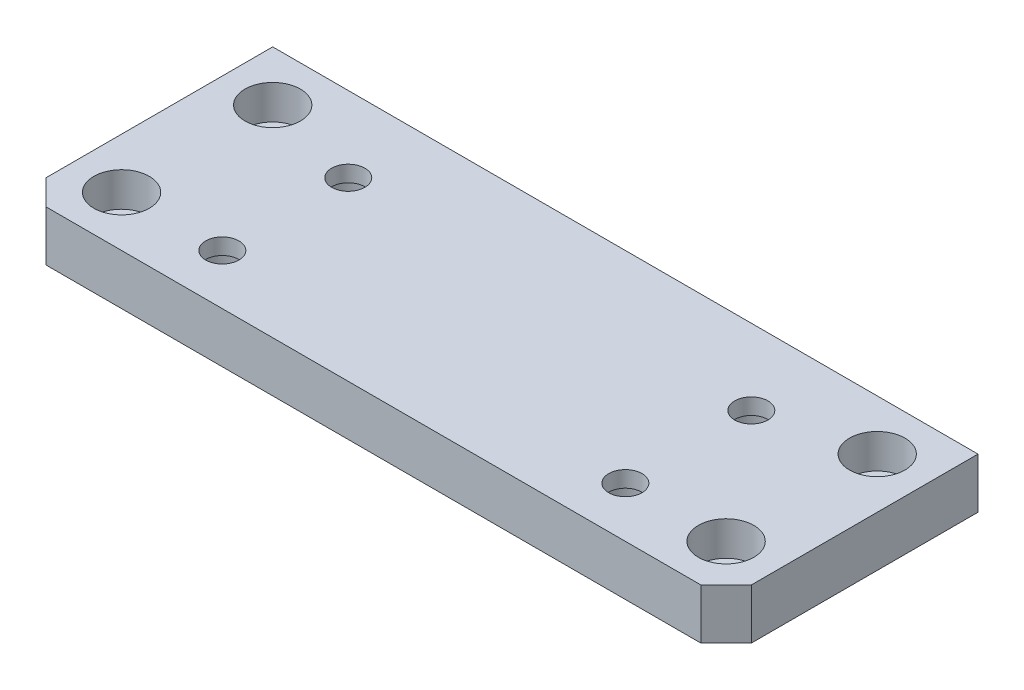
from build123d import *

# Parameters (mm, degrees)
SKETCH1_W                                            = 140
SKETCH1_H                                            = 50
BOSS_EXTRUDE1_DEPTH                                  = 10
CBORE_FOR_M6_HEXAGON_SOCKET_HEAD_CAP_SCR_D           = 6.6
CBORE_FOR_M6_HEXAGON_SOCKET_HEAD_CAP_SCR_CBORE_D     = 11
CBORE_FOR_M6_HEXAGON_SOCKET_HEAD_CAP_SCR_CBORE_DEPTH = 6.8
CBORE_FOR_M6_HEXAGON_SOCKET_HEAD_CAP_2_D             = 6.6
CBORE_FOR_M6_HEXAGON_SOCKET_HEAD_CAP_2_CBORE_D       = 11
CBORE_FOR_M6_HEXAGON_SOCKET_HEAD_CAP_2_CBORE_DEPTH   = 6.8
CHAMFER1_SIZE                                        = 5


with BuildPart() as part:
    # Sketch1 → Boss-Extrude1 (new body)
    with BuildSketch(Plane(origin=(0, 0, 0), x_dir=(1, 0, 0), z_dir=(0, 1, 0))):
        Rectangle(SKETCH1_W, SKETCH1_H)
    extrude(amount=BOSS_EXTRUDE1_DEPTH)

    # CBORE for M6 Hexagon socket head cap scr (through all)
    with Locations(Plane(origin=(0, 10, 0), x_dir=(1, 0, 0), z_dir=(0, 1, 0))):
        with Locations((-60, 15), (60, 15), (60, -15), (-60, -15)):
            CounterBoreHole(CBORE_FOR_M6_HEXAGON_SOCKET_HEAD_CAP_SCR_D / 2, CBORE_FOR_M6_HEXAGON_SOCKET_HEAD_CAP_SCR_CBORE_D / 2, CBORE_FOR_M6_HEXAGON_SOCKET_HEAD_CAP_SCR_CBORE_DEPTH)

    # CBORE for M6 Hexagon socket head cap 2 (through all)
    with Locations(Plane(origin=(0, 0, 0), x_dir=(-1, 0, 0), z_dir=(0, -1, 0))):
        with Locations((-40, 10), (-40, -15), (40, -15), (40, 10)):
            CounterBoreHole(CBORE_FOR_M6_HEXAGON_SOCKET_HEAD_CAP_2_D / 2, CBORE_FOR_M6_HEXAGON_SOCKET_HEAD_CAP_2_CBORE_D / 2, CBORE_FOR_M6_HEXAGON_SOCKET_HEAD_CAP_2_CBORE_DEPTH)

    # Chamfer1
    chamfer1_edges = [part.edges().sort_by_distance(p)[0] for p in [
        (70, 5, 25),
        (-70, 5, 25),
    ]]
    chamfer(chamfer1_edges, length=CHAMFER1_SIZE)


solid = part.part
